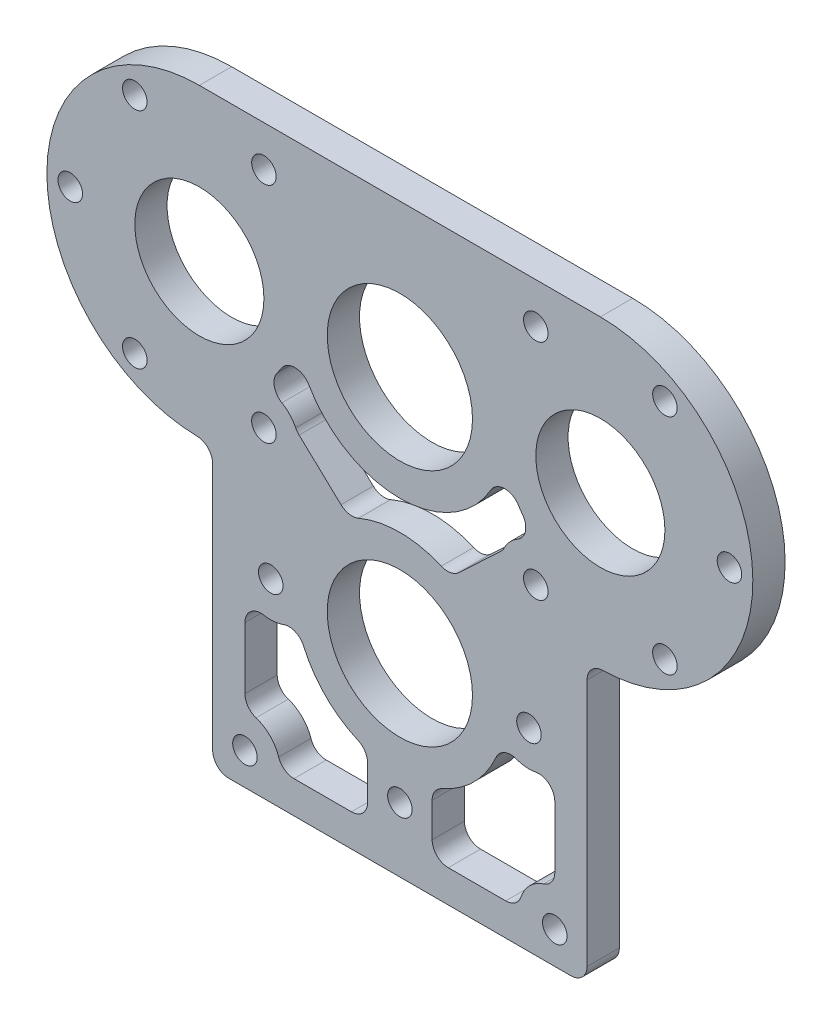
from build123d import *

# Parameters (mm, degrees)
SKETCH1_R           = 2.413
SKETCH1_R_2         = 14.2875
SKETCH1_R_3         = 12.7
BOSS_EXTRUDE1_DEPTH = 6.35
SKETCH2_R           = 2.413
CUT_EXTRUDE1_DEPTH  = 104.930431183
SKETCH3_R           = 2.413
CUT_EXTRUDE2_DEPTH  = 104.930431183
FILLET1_R           = 3.175
CUT_EXTRUDE4_DEPTH  = 104.930431183
FILLET2_R           = 3.175


with BuildPart() as part:
    # Sketch1 → Boss-Extrude1 (new body)
    with BuildSketch(Plane.XY):
        with BuildLine():
            Line((-36.83, -38.1), (36.83, -38.1))
            Line((36.83, -38.1), (36.83, 0))
            Line((36.83, 0), (36.83, 13.898506919))
            ThreePointArc((36.83, 13.898506919), (37.741105518, 16.124581216), (39.95151608, 17.07305641))
            ThreePointArc((39.95151608, 17.07305641), (69.442535879, 47.318867003), (39.4462, 77.0636))
            Line((39.4462, 77.0636), (-39.4462, 77.0636))
            ThreePointArc((-39.4462, 77.0636), (-69.442535879, 47.318867003), (-39.95151608, 17.07305641))
            ThreePointArc((-39.95151608, 17.07305641), (-37.741105518, 16.124581216), (-36.83, 13.898506919))
            Line((-36.83, 13.898506919), (-36.83, 0))
            Line((-36.83, 0), (-36.83, -38.1))
        make_face()
        with Locations((-30.48, -31.75)):
            Circle(SKETCH1_R, mode=Mode.SUBTRACT)
        with Locations((0, -25.4)):
            Circle(SKETCH1_R, mode=Mode.SUBTRACT)
        with Locations((30.48, -31.75)):
            Circle(SKETCH1_R, mode=Mode.SUBTRACT)
        Circle(SKETCH1_R_2, mode=Mode.SUBTRACT)
        with Locations((-39.4462, 47.0662)):
            Circle(SKETCH1_R_3, mode=Mode.SUBTRACT)
        with Locations((0, 47.0662)):
            Circle(SKETCH1_R_2, mode=Mode.SUBTRACT)
        with Locations((39.4462, 47.0662)):
            Circle(SKETCH1_R_3, mode=Mode.SUBTRACT)
        with Locations((52.1462, 69.063245256)):
            Circle(SKETCH1_R, mode=Mode.SUBTRACT)
    extrude(amount=BOSS_EXTRUDE1_DEPTH)

    # Sketch2 → Cut-Extrude1 (cut, through all)
    with BuildSketch(Plane.XY.offset(6.35)):
        with Locations((-25.4, 0)):
            Circle(SKETCH2_R)
        with Locations((25.4, 0)):
            Circle(SKETCH2_R)
    extrude(amount=-CUT_EXTRUDE1_DEPTH, mode=Mode.SUBTRACT)

    # Sketch3 → Cut-Extrude2 (cut, through all)
    with BuildSketch(Plane.XY.offset(6.35)):
        with Locations((-26.7462, 25.069154744)):
            Circle(SKETCH3_R)
        with Locations((-52.1462, 25.069154744)):
            Circle(SKETCH3_R)
        with Locations((-64.8462, 47.0662)):
            Circle(SKETCH3_R)
        with Locations((-52.1462, 69.063245256)):
            Circle(SKETCH3_R)
        with Locations((-26.7462, 69.063245256)):
            Circle(SKETCH3_R)
        with Locations((26.7462, 25.069154744)):
            Circle(SKETCH3_R)
        with Locations((52.1462, 25.069154744)):
            Circle(SKETCH3_R)
        with Locations((52.1462, 69.063245256)):
            Circle(SKETCH3_R)
        with Locations((64.8462, 47.0662)):
            Circle(SKETCH3_R)
        with Locations((26.7462, 69.063245256)):
            Circle(SKETCH3_R)
    extrude(amount=-CUT_EXTRUDE2_DEPTH, mode=Mode.SUBTRACT)

    # Fillet1
    fillet1_edges = [part.edges().sort_by_distance(p)[0] for p in [
        (36.83, -38.1, 3.175),
        (-36.83, -38.1, 3.175),
    ]]
    fillet(fillet1_edges, radius=FILLET1_R)

    # Sketch4 → Cut-Extrude4 (cut, through all)
    with BuildSketch(Plane.XY.offset(6.35)):
        with BuildLine():
            Line((-20.280551981, 27.712187223), (-9.984322179, 18.061553557))
            ThreePointArc((-9.984322179, 18.061553557), (0, 20.6375), (9.984322179, 18.061553557))
            Line((9.984322179, 18.061553557), (20.280551981, 27.712187223))
            ThreePointArc((20.280551981, 27.712187223), (23.31373077, 31.152606065), (27.826871421, 31.970051372))
            ThreePointArc((27.826871421, 31.970051372), (22.865552696, 37.686187475), (20.521705522, 44.883080962))
            ThreePointArc((20.521705522, 44.883080962), (0, 26.4287), (-20.521705522, 44.883080962))
            ThreePointArc((-20.521705522, 44.883080962), (-22.865552696, 37.686187475), (-27.826871421, 31.970051372))
            ThreePointArc((-27.826871421, 31.970051372), (-23.31373077, 31.152606065), (-20.280551981, 27.712187223))
        make_face()
        with BuildLine():
            ThreePointArc((20.123546875, -4.577036969), (15.228507825, -13.928350788), (6.35, -19.636290542))
            Line((6.35, -19.636290542), (6.35, -31.75))
            Line((6.35, -31.75), (23.495, -31.75))
            ThreePointArc((23.495, -31.75), (25.540859133, -26.810859133), (30.48, -24.765))
            Line((30.48, -24.765), (30.48, -4.794144866))
            ThreePointArc((30.48, -4.794144866), (25.253601853, -6.983465657), (20.123546875, -4.577036969))
        make_face()
        with BuildLine():
            Line((-6.35, -31.75), (-6.35, -19.636290542))
            ThreePointArc((-6.35, -19.636290542), (-15.228507825, -13.928350788), (-20.123546875, -4.577036969))
            ThreePointArc((-20.123546875, -4.577036969), (-25.253601853, -6.983465657), (-30.48, -4.794144866))
            Line((-30.48, -4.794144866), (-30.48, -24.765))
            ThreePointArc((-30.48, -24.765), (-25.540859133, -26.810859133), (-23.495, -31.75))
            Line((-23.495, -31.75), (-6.35, -31.75))
        make_face()
    extrude(amount=-CUT_EXTRUDE4_DEPTH, mode=Mode.SUBTRACT)

    # Fillet2
    fillet2_edges = [part.edges().sort_by_distance(p)[0] for p in [
        (-27.826871421, 31.970051372, 3.175),
        (-20.521705522, 44.883080962, 3.175),
        (20.521705522, 44.883080962, 3.175),
        (27.826871421, 31.970051372, 3.175),
        (20.280551981, 27.712187223, 3.175),
        (9.984322179, 18.061553557, 3.175),
        (-9.984322179, 18.061553557, 3.175),
        (-20.280551981, 27.712187223, 3.175),
        (20.123546875, -4.577036969, 3.175),
        (30.48, -4.794144866, 3.175),
        (30.48, -24.765, 3.175),
        (23.495, -31.75, 3.175),
        (6.35, -31.75, 3.175),
        (6.35, -19.636290542, 3.175),
        (-30.48, -4.794144866, 3.175),
        (-20.123546875, -4.577036969, 3.175),
        (-6.35, -19.636290542, 3.175),
        (-6.35, -31.75, 3.175),
        (-23.495, -31.75, 3.175),
        (-30.48, -24.765, 3.175),
    ]]
    fillet(fillet2_edges, radius=FILLET2_R)


solid = part.part
